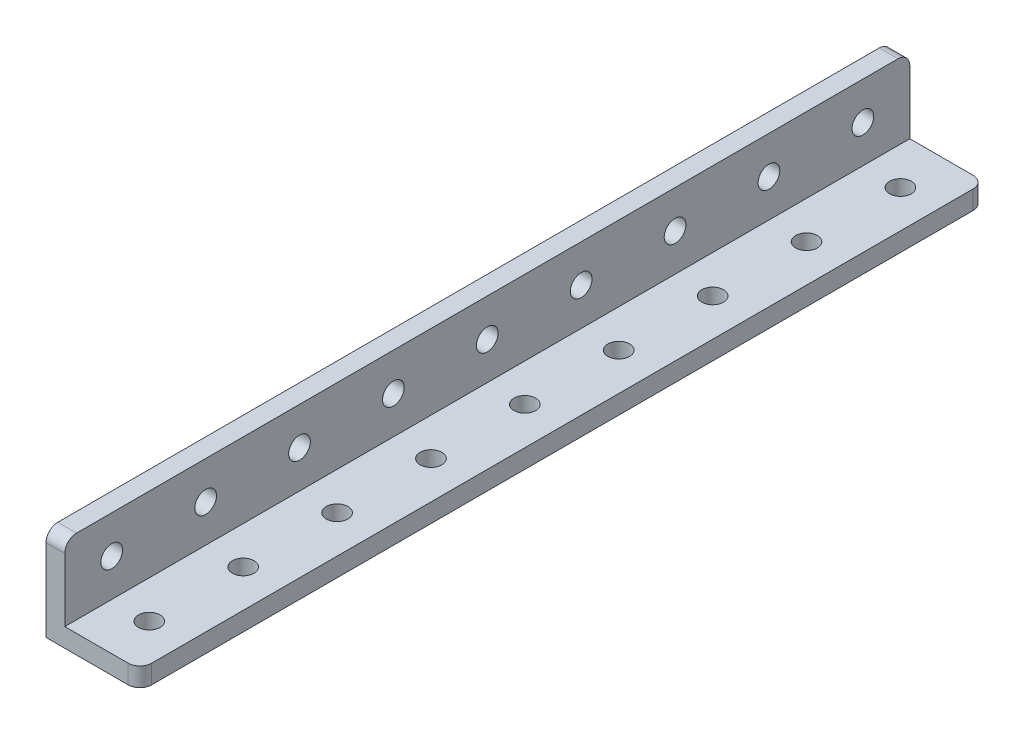
from build123d import *

# Parameters (mm, degrees)
SKETCH1_W                      = 144
SKETCH1_H                      = 16
BOSS_EXTRUDE1_DEPTH            = 16
SKETCH2_W                      = 12.8
SKETCH2_H                      = 12.8
CUT_EXTRUDE1_DEPTH             = 146.766937266
F_3_7_3_7_DIAMETER_HOLE1_D     = 3.7
F_3_7_3_7_DIAMETER_HOLE1_DEPTH = 16
F_3_7_3_7_DIAMETER_HOLE2_D     = 3.7
F_3_7_3_7_DIAMETER_HOLE2_DEPTH = 16
FILLET1_R                      = 2


with BuildPart() as part:
    # Sketch1 → Boss-Extrude1 (new body)
    with BuildSketch(Plane(origin=(16, 0, 0), x_dir=(0, 0, -1), z_dir=(1, 0, 0))):
        with Locations((72, 8)):
            Rectangle(SKETCH1_W, SKETCH1_H)
    extrude(amount=-BOSS_EXTRUDE1_DEPTH)

    # Sketch2 → Cut-Extrude1 (cut, through all)
    with BuildSketch(Plane.XY):
        with Locations((9.6, 9.6)):
            Rectangle(SKETCH2_W, SKETCH2_H)
    extrude(amount=-CUT_EXTRUDE1_DEPTH, mode=Mode.SUBTRACT)

    # Ø3.7 (3.7) Diameter Hole1
    with Locations(Plane.ZY):
        with Locations((-24, 9.6), (-40, 9.6), (-56, 9.6), (-72, 9.6), (-88, 9.6), (-104, 9.6), (-120, 9.6), (-136, 9.6), (-8, 9.6)):
            Hole(F_3_7_3_7_DIAMETER_HOLE1_D / 2, depth=F_3_7_3_7_DIAMETER_HOLE1_DEPTH)

    # Ø3.7 (3.7) Diameter Hole2
    with Locations(Plane(origin=(0, 0, 0), x_dir=(-1, 0, 0), z_dir=(0, -1, 0))):
        with Locations((-9.6, 24), (-9.6, 40), (-9.6, 56), (-9.6, 72), (-9.6, 88), (-9.6, 104), (-9.6, 120), (-9.6, 136), (-9.6, 8)):
            Hole(F_3_7_3_7_DIAMETER_HOLE2_D / 2, depth=F_3_7_3_7_DIAMETER_HOLE2_DEPTH)

    # Fillet1
    fillet1_edges = [part.edges().sort_by_distance(p)[0] for p in [
        (16, 1.6, 0),
        (16, 1.6, -144),
        (1.6, 16, 0),
        (1.6, 16, -144),
    ]]
    fillet(fillet1_edges, radius=FILLET1_R)


solid = part.part
